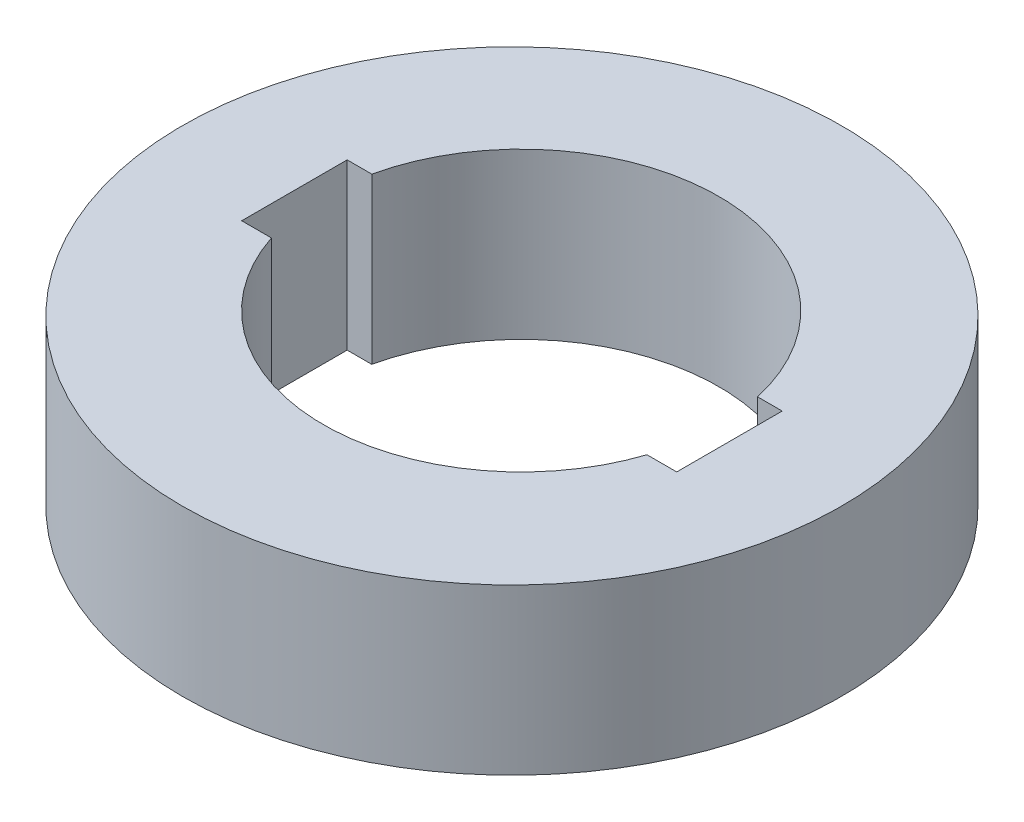
from build123d import *

# Parameters (mm, degrees)
SKETCH2_R           = 50
BOSS_EXTRUDE1_DEPTH = 25


with BuildPart() as part:
    # Sketch2 → Boss-Extrude1 (new body)
    with BuildSketch(Plane(origin=(0, 0, 0), x_dir=(1, 0, 0), z_dir=(0, 1, 0))):
        with Locations(Location((0, 0, 0), (0, 0, 270))):
            Circle(SKETCH2_R)
        with BuildLine():
            Line((33, 0), (33, 8))
            Line((33, 8), (29.265964208, 8))
            ThreePointArc((29.265964208, 8), (0, 31.404293899), (-29.265964208, 8))
            Line((-29.265964208, 8), (-33, 8))
            Line((-33, 8), (-33, 0))
            Line((-33, 0), (-33, -8))
            Line((-33, -8), (-28.487879111, -8))
            ThreePointArc((-28.487879111, -8), (0, -28.595706101), (28.487879111, -8))
            Line((28.487879111, -8), (33, -8))
            Line((33, -8), (33, 0))
        make_face(mode=Mode.SUBTRACT)
    extrude(amount=-BOSS_EXTRUDE1_DEPTH)


solid = part.part
